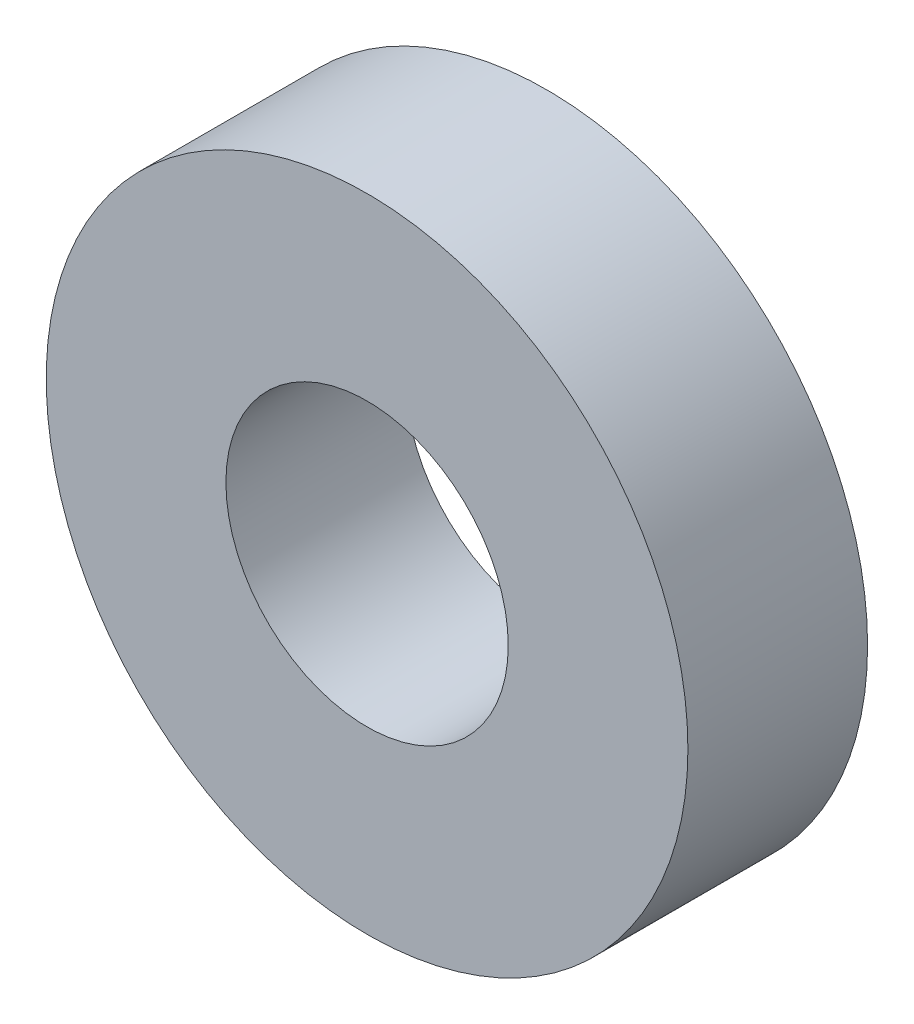
from build123d import *

# Parameters (mm, degrees)
SKETCH2_R           = 25
SKETCH2_R_2         = 11
BOSS_EXTRUDE1_DEPTH = 14


with BuildPart() as part:
    # Sketch2 → Boss-Extrude1 (new body)
    with BuildSketch(Plane.XY):
        Circle(SKETCH2_R)
        Circle(SKETCH2_R_2, mode=Mode.SUBTRACT)
    extrude(amount=BOSS_EXTRUDE1_DEPTH)


solid = part.part
